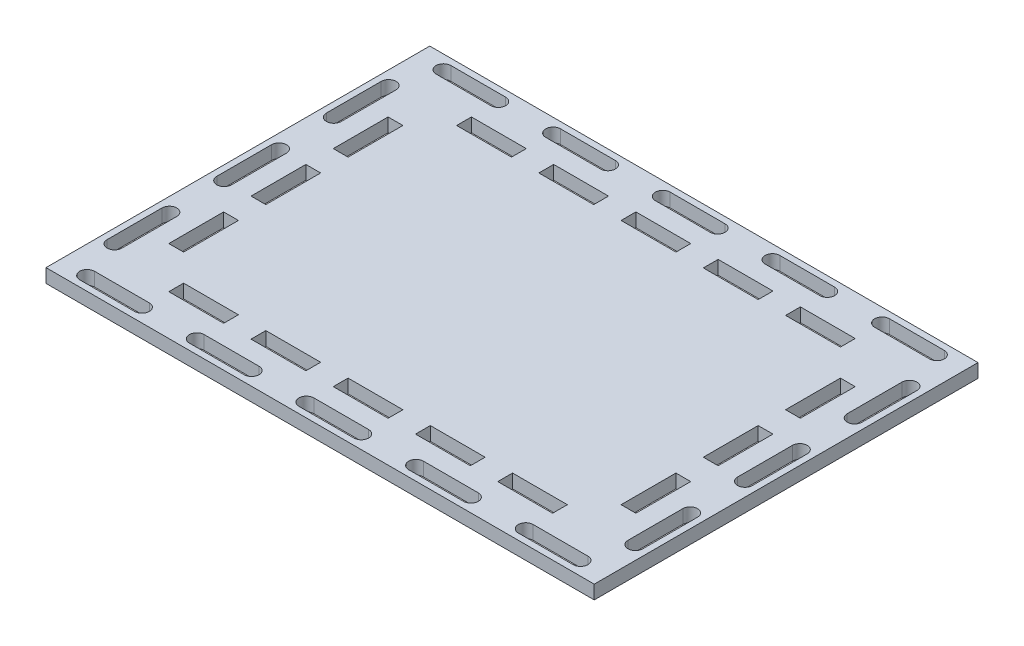
from build123d import *

# Parameters (mm, degrees)
SKETCH1_W           = 254
SKETCH1_H           = 177.8
BOSS_EXTRUDE1_DEPTH = 6.35
SKETCH2_W           = 25.4
SKETCH2_H           = 6.858
SKETCH2_W_2         = 6.858
SKETCH2_H_2         = 25.4
CUT_EXTRUDE1_DEPTH  = 156.15325488


with BuildPart() as part:
    # Sketch1 → Boss-Extrude1 (new body)
    with BuildSketch(Plane(origin=(0, 0, 0), x_dir=(1, 0, 0), z_dir=(0, 1, 0))):
        Rectangle(SKETCH1_W, SKETCH1_H)
    extrude(amount=BOSS_EXTRUDE1_DEPTH)

    # Sketch2 → Cut-Extrude1 (cut, through all)
    with BuildSketch(Plane(origin=(0, 0, 0), x_dir=(1, 0, 0), z_dir=(0, 1, 0))):
        with Locations((76.2, 66.675)):
            Rectangle(SKETCH2_W, SKETCH2_H)
        with Locations((-76.2, 66.675)):
            Rectangle(SKETCH2_W, SKETCH2_H)
        with BuildLine():
            Line((38.1, 85.979), (63.5, 85.979))
            ThreePointArc((63.5, 85.979), (66.929, 82.55), (63.5, 79.121))
            Line((63.5, 79.121), (38.1, 79.121))
            ThreePointArc((38.1, 79.121), (34.671, 82.55), (38.1, 85.979))
        make_face()
        with BuildLine():
            Line((88.9, 85.979), (114.3, 85.979))
            ThreePointArc((114.3, 85.979), (117.729, 82.55), (114.3, 79.121))
            Line((114.3, 79.121), (88.9, 79.121))
            ThreePointArc((88.9, 79.121), (85.471, 82.55), (88.9, 85.979))
        make_face()
        with BuildLine():
            Line((-114.3, 85.979), (-88.9, 85.979))
            ThreePointArc((-88.9, 85.979), (-85.471, 82.55), (-88.9, 79.121))
            Line((-88.9, 79.121), (-114.3, 79.121))
            ThreePointArc((-114.3, 79.121), (-117.729, 82.55), (-114.3, 85.979))
        make_face()
        with Locations((38.1, 66.675)):
            Rectangle(SKETCH2_W, SKETCH2_H)
        with BuildLine():
            Line((-63.5, 85.979), (-38.1, 85.979))
            ThreePointArc((-38.1, 85.979), (-34.671, 82.55), (-38.1, 79.121))
            Line((-38.1, 79.121), (-63.5, 79.121))
            ThreePointArc((-63.5, 79.121), (-66.929, 82.55), (-63.5, 85.979))
        make_face()
        with BuildLine():
            Line((-12.7, 85.979), (12.7, 85.979))
            ThreePointArc((12.7, 85.979), (16.129, 82.55), (12.7, 79.121))
            Line((12.7, 79.121), (-12.7, 79.121))
            ThreePointArc((-12.7, 79.121), (-16.129, 82.55), (-12.7, 85.979))
        make_face()
        with Locations((-104.775, 38.1)):
            Rectangle(SKETCH2_W_2, SKETCH2_H_2)
        with Locations((-104.775, 0)):
            Rectangle(SKETCH2_W_2, SKETCH2_H_2)
        with Locations((0, 66.675)):
            Rectangle(SKETCH2_W, SKETCH2_H)
        with Locations((-38.1, 66.675)):
            Rectangle(SKETCH2_W, SKETCH2_H)
        with BuildLine():
            Line((-124.079, -12.7), (-124.079, 12.7))
            ThreePointArc((-124.079, 12.7), (-120.65, 16.129), (-117.221, 12.7))
            Line((-117.221, 12.7), (-117.221, -12.7))
            ThreePointArc((-117.221, -12.7), (-120.65, -16.129), (-124.079, -12.7))
        make_face()
        with Locations((-104.775, -38.1)):
            Rectangle(SKETCH2_W_2, SKETCH2_H_2)
        with BuildLine():
            Line((-124.079, 38.1), (-124.079, 63.5))
            ThreePointArc((-124.079, 63.5), (-120.65, 66.929), (-117.221, 63.5))
            Line((-117.221, 63.5), (-117.221, 38.1))
            ThreePointArc((-117.221, 38.1), (-120.65, 34.671), (-124.079, 38.1))
        make_face()
        with BuildLine():
            Line((-124.079, -63.5), (-124.079, -38.1))
            ThreePointArc((-124.079, -38.1), (-120.65, -34.671), (-117.221, -38.1))
            Line((-117.221, -38.1), (-117.221, -63.5))
            ThreePointArc((-117.221, -63.5), (-120.65, -66.929), (-124.079, -63.5))
        make_face()
        with BuildLine():
            Line((124.079, -12.7), (124.079, 12.7))
            ThreePointArc((124.079, 12.7), (120.65, 16.129), (117.221, 12.7))
            Line((117.221, 12.7), (117.221, -12.7))
            ThreePointArc((117.221, -12.7), (120.65, -16.129), (124.079, -12.7))
        make_face()
        with BuildLine():
            Line((124.079, 38.1), (124.079, 63.5))
            ThreePointArc((124.079, 63.5), (120.65, 66.929), (117.221, 63.5))
            Line((117.221, 63.5), (117.221, 38.1))
            ThreePointArc((117.221, 38.1), (120.65, 34.671), (124.079, 38.1))
        make_face()
        with BuildLine():
            Line((124.079, -63.5), (124.079, -38.1))
            ThreePointArc((124.079, -38.1), (120.65, -34.671), (117.221, -38.1))
            Line((117.221, -38.1), (117.221, -63.5))
            ThreePointArc((117.221, -63.5), (120.65, -66.929), (124.079, -63.5))
        make_face()
        with Locations((104.775, -38.1)):
            Rectangle(SKETCH2_W_2, SKETCH2_H_2)
        with Locations((104.775, 38.1)):
            Rectangle(SKETCH2_W_2, SKETCH2_H_2)
        with Locations((104.775, 0)):
            Rectangle(SKETCH2_W_2, SKETCH2_H_2)
        with Locations((-38.1, -66.675)):
            Rectangle(SKETCH2_W, SKETCH2_H)
        with Locations((38.1, -66.675)):
            Rectangle(SKETCH2_W, SKETCH2_H)
        with Locations((0, -66.675)):
            Rectangle(SKETCH2_W, SKETCH2_H)
        with BuildLine():
            Line((12.7, -79.121), (-12.7, -79.121))
            ThreePointArc((-12.7, -79.121), (-16.129, -82.55), (-12.7, -85.979))
            Line((-12.7, -85.979), (12.7, -85.979))
            ThreePointArc((12.7, -85.979), (16.129, -82.55), (12.7, -79.121))
        make_face()
        with BuildLine():
            Line((-38.1, -79.121), (-63.5, -79.121))
            ThreePointArc((-63.5, -79.121), (-66.929, -82.55), (-63.5, -85.979))
            Line((-63.5, -85.979), (-38.1, -85.979))
            ThreePointArc((-38.1, -85.979), (-34.671, -82.55), (-38.1, -79.121))
        make_face()
        with BuildLine():
            Line((-88.9, -79.121), (-114.3, -79.121))
            ThreePointArc((-114.3, -79.121), (-117.729, -82.55), (-114.3, -85.979))
            Line((-114.3, -85.979), (-88.9, -85.979))
            ThreePointArc((-88.9, -85.979), (-85.471, -82.55), (-88.9, -79.121))
        make_face()
        with BuildLine():
            Line((114.3, -79.121), (88.9, -79.121))
            ThreePointArc((88.9, -79.121), (85.471, -82.55), (88.9, -85.979))
            Line((88.9, -85.979), (114.3, -85.979))
            ThreePointArc((114.3, -85.979), (117.729, -82.55), (114.3, -79.121))
        make_face()
        with BuildLine():
            Line((63.5, -79.121), (38.1, -79.121))
            ThreePointArc((38.1, -79.121), (34.671, -82.55), (38.1, -85.979))
            Line((38.1, -85.979), (63.5, -85.979))
            ThreePointArc((63.5, -85.979), (66.929, -82.55), (63.5, -79.121))
        make_face()
        with Locations((-76.2, -66.675)):
            Rectangle(SKETCH2_W, SKETCH2_H)
        with Locations((76.2, -66.675)):
            Rectangle(SKETCH2_W, SKETCH2_H)
    extrude(amount=CUT_EXTRUDE1_DEPTH, mode=Mode.SUBTRACT)


solid = part.part
